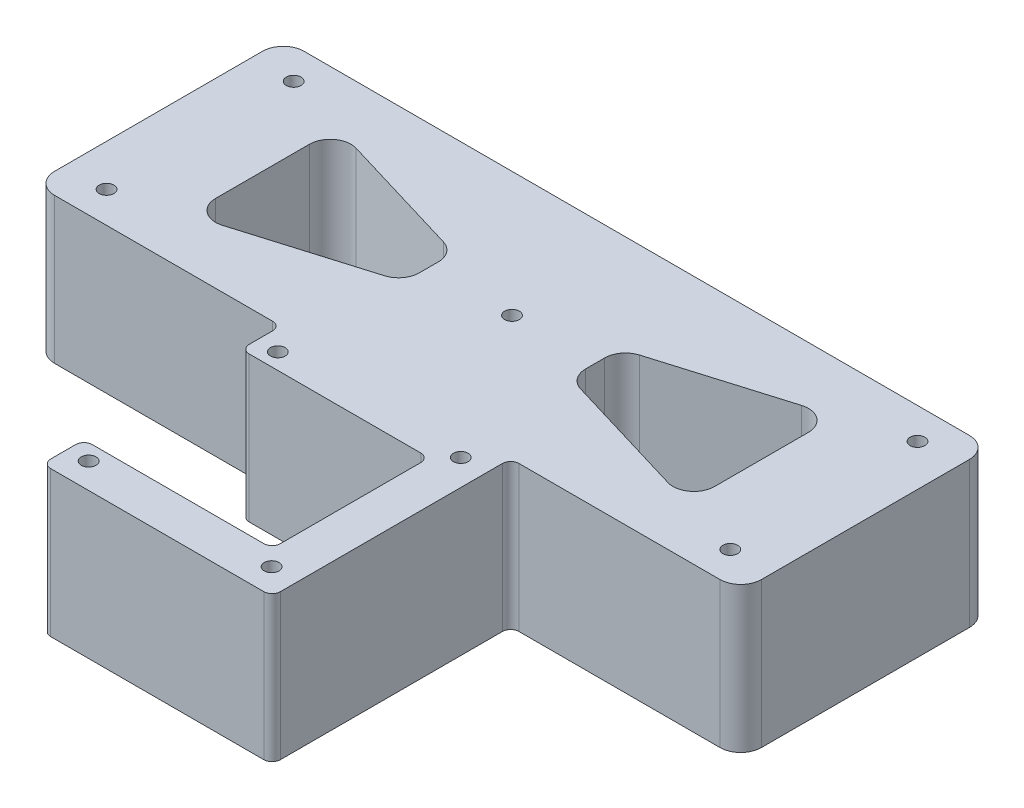
from build123d import *

# Parameters (mm, degrees)
BOSS_EXTRUDE1_DEPTH   = 44.45
FILLET1_R             = 6.35
F_8_CLEARANCE_HOLE1_D = 4.4958
FILLET2_R             = 2.54


with BuildPart() as part:
    # Sketch1 → Boss-Extrude1 (new body)
    with BuildSketch(Plane(origin=(0, 0, 0), x_dir=(1, 0, 0), z_dir=(0, 1, 0))):
        Polygon((37.70376, -38.1), (107.95, -38.1), (107.95, 38.1), (-107.95, 38.1), (-107.95, -38.1), (-32.46374, -38.1), (-32.46374, -50.327357955), (25.00376, -50.327357955), (25.00376, -98.262642045), (-32.46374, -98.262642045), (-32.46374, -110.962642045), (37.70376, -110.962642045), align=None)
        Polygon((-76.2, -22.86), (-76.2, 22.86), (-25.4, 7.62), (-25.4, -7.62), align=None, mode=Mode.SUBTRACT)
        Polygon((25.4, -7.62), (25.4, 7.62), (76.2, 22.86), (76.2, -22.86), align=None, mode=Mode.SUBTRACT)
    extrude(amount=BOSS_EXTRUDE1_DEPTH)

    # Fillet1
    fillet1_edges = [part.edges().sort_by_distance(p)[0] for p in [
        (-107.95, 22.225, -38.1),
        (107.95, 22.225, -38.1),
        (107.95, 22.225, 38.1),
        (-107.95, 22.225, 38.1),
        (-76.2, 22.225, -22.86),
        (-76.2, 22.225, 22.86),
        (-25.4, 22.225, 7.62),
        (-25.4, 22.225, -7.62),
        (25.4, 22.225, -7.62),
        (25.4, 22.225, 7.62),
        (76.2, 22.225, 22.86),
        (76.2, 22.225, -22.86),
    ]]
    fillet(fillet1_edges, radius=FILLET1_R)

    # #8 Clearance Hole1 (through all)
    with Locations(Plane(origin=(0, 44.45, 0), x_dir=(1, 0, 0), z_dir=(0, 1, 0))):
        with Locations((95.25, 28.575), (95.25, -28.575), (-95.25, 28.575), (-95.25, -28.575), (0, 0), (-26.11374, -45.4025), (29.76626, -45.4025), (29.76626, -103.1875), (-26.11374, -103.1875)):
            Hole(F_8_CLEARANCE_HOLE1_D / 2)

    # Fillet2
    fillet2_edges = [part.edges().sort_by_distance(p)[0] for p in [
        (37.70376, 22.225, 38.1),
        (37.70376, 22.225, 110.962642045),
        (-32.46374, 22.225, 110.962642045),
        (-32.46374, 22.225, 98.262642045),
        (25.00376, 22.225, 98.262642045),
        (25.00376, 22.225, 50.327357955),
        (-32.46374, 22.225, 50.327357955),
        (-32.46374, 22.225, 38.1),
    ]]
    fillet(fillet2_edges, radius=FILLET2_R)


solid = part.part
